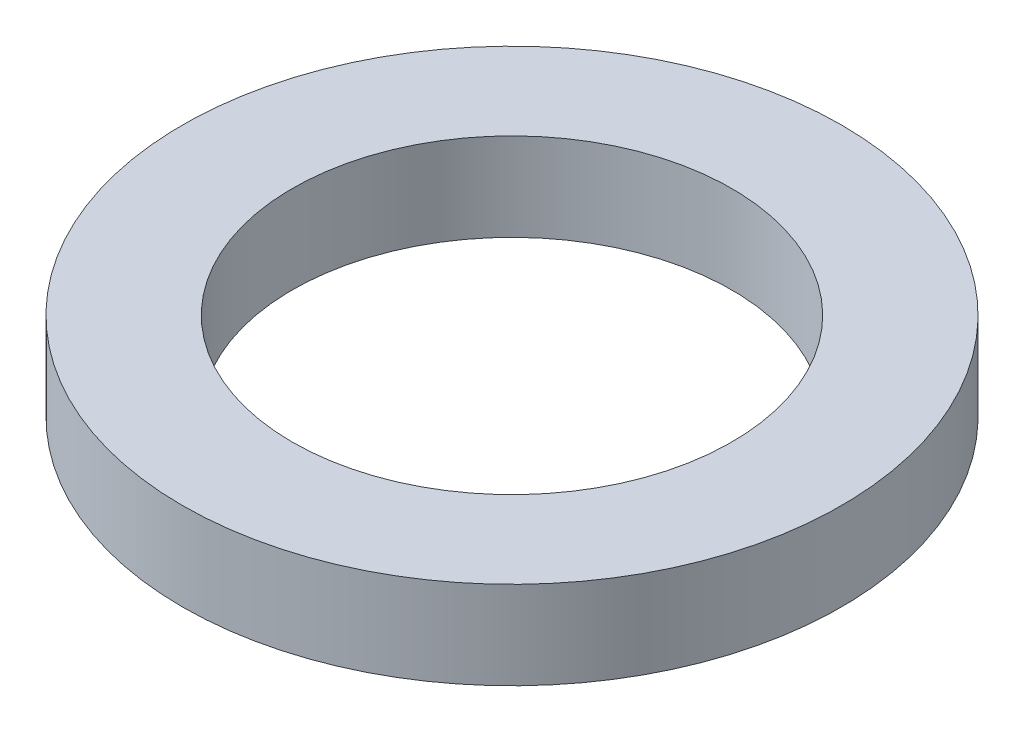
from build123d import *

# Parameters (mm, degrees)
SKETCH1_R           = 9.525
BOSS_EXTRUDE1_DEPTH = 2.54
SKETCH2_R           = 6.35
CUT_EXTRUDE1_DEPTH  = 2.54


with BuildPart() as part:
    # Sketch1 → Boss-Extrude1 (new body)
    with BuildSketch(Plane(origin=(0, 0, 0), x_dir=(1, 0, 0), z_dir=(0, 1, 0))):
        with Locations(Location((0, 0, 0), (0, 0, 270))):
            Circle(SKETCH1_R)
    extrude(amount=BOSS_EXTRUDE1_DEPTH)

    # Sketch2 → Cut-Extrude1 (cut)
    with BuildSketch(Plane(origin=(0, 2.54, 0), x_dir=(1, 0, 0), z_dir=(0, 1, 0))):
        with Locations(Location((0, 0, 0), (0, 0, 270))):
            Circle(SKETCH2_R)
    extrude(amount=-CUT_EXTRUDE1_DEPTH, mode=Mode.SUBTRACT)


solid = part.part
